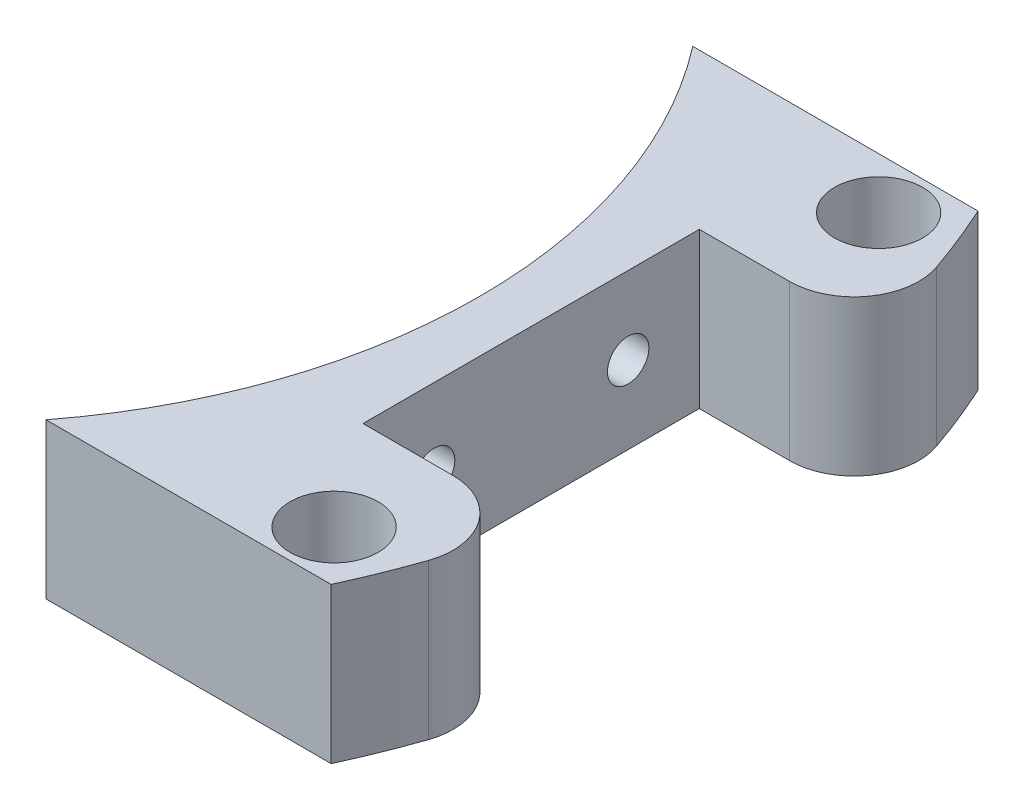
from build123d import *

# Parameters (mm, degrees)
SKETCH_1_R          = 3.4
EXTRUDE_2_DEPTH     = 12
CUT_EXTRUDE_1_DEPTH = 104.289186422
CUT_EXTRUDE_2_DEPTH = 103.326519441
CUT_EXTRUDE_START   = -10
SKETCH_6_R          = 3.5
SKETCH_6_R_2        = 1.6
CUT_EXTRUDE_3_DEPTH = 10
FILLET_1_R          = 5


with BuildPart() as part:
    # 草图1 → 凸台-拉伸2 (new body)
    with BuildSketch(Plane(origin=(0, 0, 0), x_dir=(1, 0, 0), z_dir=(0, 1, 0))):
        with BuildLine():
            ThreePointArc((-7.95357839, 100.709696918), (0.550267992, 75.709696918), (-7.95357839, 50.709696918))
            Line((-7.95357839, 50.709696918), (14.093828565, 50.709696918))
            ThreePointArc((14.093828565, 50.709696918), (19.550267992, 75.709696918), (14.093828565, 100.709696918))
            Line((14.093828565, 100.709696918), (-7.95357839, 100.709696918))
        make_face()
        with Locations(Location((10.36364228, 96.757285698, 0), (0, 0, 270))):
            Circle(SKETCH_1_R, mode=Mode.SUBTRACT)
        with Locations(Location((10.36364228, 54.662108138, 0), (0, 0, 270))):
            Circle(SKETCH_1_R, mode=Mode.SUBTRACT)
    extrude(amount=EXTRUDE_2_DEPTH)

    # 草图2 → 切除-拉伸1 (cut, through all)
    with BuildSketch(Plane(origin=(0, 12, 0), x_dir=(1, 0, 0), z_dir=(0, 1, 0))):
        with BuildLine():
            Line((4.550267992, 88.709696918), (4.550267992, 75.709696918))
            Line((4.550267992, 75.709696918), (19.550267992, 75.709696918))
            ThreePointArc((19.550267992, 75.709696918), (19.192888302, 82.248645039), (18.125006574, 88.709696918))
            Line((18.125006574, 88.709696918), (4.550267992, 88.709696918))
        make_face()
        with BuildLine():
            Line((19.550267992, 75.709696918), (4.550267992, 75.709696918))
            Line((4.550267992, 75.709696918), (4.550267992, 62.709696918))
            Line((4.550267992, 62.709696918), (18.125006574, 62.709696918))
            ThreePointArc((18.125006574, 62.709696918), (19.192888302, 69.170748797), (19.550267992, 75.709696918))
        make_face()
    extrude(amount=-CUT_EXTRUDE_1_DEPTH, mode=Mode.SUBTRACT)

    # 草图4 → 切除-拉伸2 (cut, through all)
    with BuildSketch(Plane(origin=(4.550267992, 0, 0), x_dir=(0, 0, -1), z_dir=(1, 0, 0))):
        with BuildLine():
            ThreePointArc((84.809696918, 6), (83.209696918, 7.6), (81.609696918, 6))
            Line((81.609696918, 6), (84.809696918, 6))
        make_face()
        with BuildLine():
            Line((84.809696918, 6), (81.609696918, 6))
            ThreePointArc((81.609696918, 6), (83.209696918, 4.4), (84.809696918, 6))
        make_face()
        with BuildLine():
            ThreePointArc((69.809696918, 6), (68.209696918, 7.6), (66.609696918, 6))
            Line((66.609696918, 6), (69.809696918, 6))
        make_face()
        with BuildLine():
            Line((69.809696918, 6), (66.609696918, 6))
            ThreePointArc((66.609696918, 6), (68.209696918, 4.4), (69.809696918, 6))
        make_face()
    extrude(amount=-CUT_EXTRUDE_2_DEPTH, mode=Mode.SUBTRACT)

    # 草图6 → 切除-拉伸3 (cut)
    # profile 1 of 2: a face of its own
    with BuildSketch(Plane.ZY.offset(7.95357839).offset(CUT_EXTRUDE_START)):
        with Locations((-83.209696918, 6)):
            Circle(SKETCH_6_R)
        with Locations(Location((-83.209696918, 6, 0), (0, 0, 180))):
            Circle(SKETCH_6_R_2, mode=Mode.SUBTRACT)
    # profile 2 of 2: a face of its own
    with BuildSketch(Plane.ZY.offset(7.95357839).offset(CUT_EXTRUDE_START)):
        with Locations((-68.209696918, 6)):
            Circle(SKETCH_6_R)
        with Locations(Location((-68.209696918, 6, 0), (0, 0, 180))):
            Circle(SKETCH_6_R_2, mode=Mode.SUBTRACT)
    extrude(amount=CUT_EXTRUDE_3_DEPTH, mode=Mode.SUBTRACT)

    # 圆角1
    fillet_1_edges = [part.edges().sort_by_distance(p)[0] for p in [
        (18.125006574, 6, -88.709696918),
        (18.125006574, 6, -62.709696918),
    ]]
    fillet(fillet_1_edges, radius=FILLET_1_R)


solid = part.part
